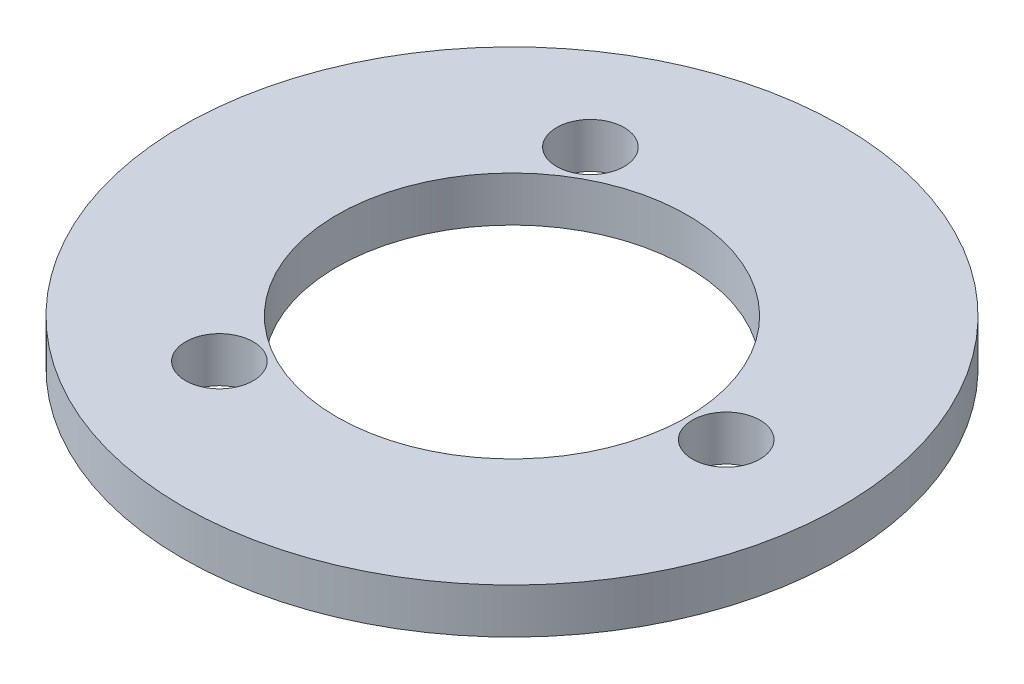
from build123d import *

# Parameters (mm, degrees)
SKETCH1_R           = 14.616636411
SKETCH1_R_2         = 7.766732205
SKETCH1_R_3         = 1.5
BOSS_EXTRUDE1_DEPTH = 2


with BuildPart() as part:
    # Sketch1 → Boss-Extrude1 (new body)
    with BuildSketch(Plane(origin=(0, 0, 0), x_dir=(1, 0, 0), z_dir=(0, 1, 0))):
        with Locations(Location((-32.245903782, 16.786036403, 0), (0, 0, 270))):
            Circle(SKETCH1_R)
        with Locations(Location((-32.245903782, 16.786036403, 0), (0, 0, 270))):
            Circle(SKETCH1_R_2, mode=Mode.SUBTRACT)
        with Locations(Location((-36.995884149, 8.558783732, 0), (0, 0, 270))):
            Circle(SKETCH1_R_3, mode=Mode.SUBTRACT)
        with Locations(Location((-36.995923414, 25.013266404, 0), (0, 0, 270))):
            Circle(SKETCH1_R_3, mode=Mode.SUBTRACT)
        with Locations(Location((-22.745903782, 16.786059073, 0), (0, 0, 270))):
            Circle(SKETCH1_R_3, mode=Mode.SUBTRACT)
    extrude(amount=BOSS_EXTRUDE1_DEPTH)


solid = part.part
